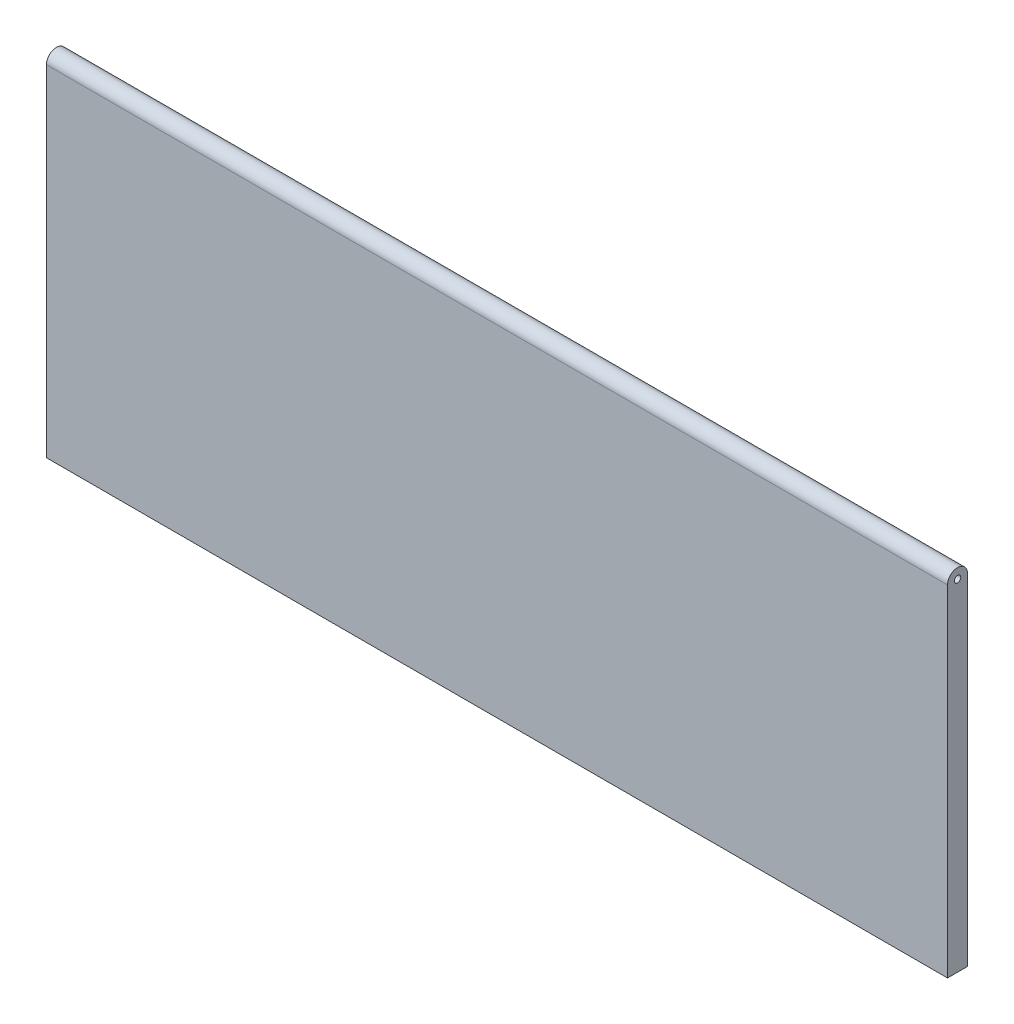
from build123d import *

# Parameters (mm, degrees)
SKETCH5_R           = 0.8255
BOSS_EXTRUDE2_DEPTH = 228.6


with BuildPart() as part:
    # Sketch5 → Boss-Extrude2 (new body)
    with BuildSketch(Plane(origin=(0, 0, 0), x_dir=(0, 0, -1), z_dir=(1, 0, 0))):
        with BuildLine():
            Line((-2.54, -44.45), (2.54, -44.45))
            Line((2.54, -44.45), (2.54, 41.91))
            ThreePointArc((2.54, 41.91), (0, 44.45), (-2.54, 41.91))
            Line((-2.54, 41.91), (-2.54, -44.45))
        make_face()
        with Locations((0, 41.91)):
            Circle(SKETCH5_R, mode=Mode.SUBTRACT)
    extrude(amount=BOSS_EXTRUDE2_DEPTH)


solid = part.part
